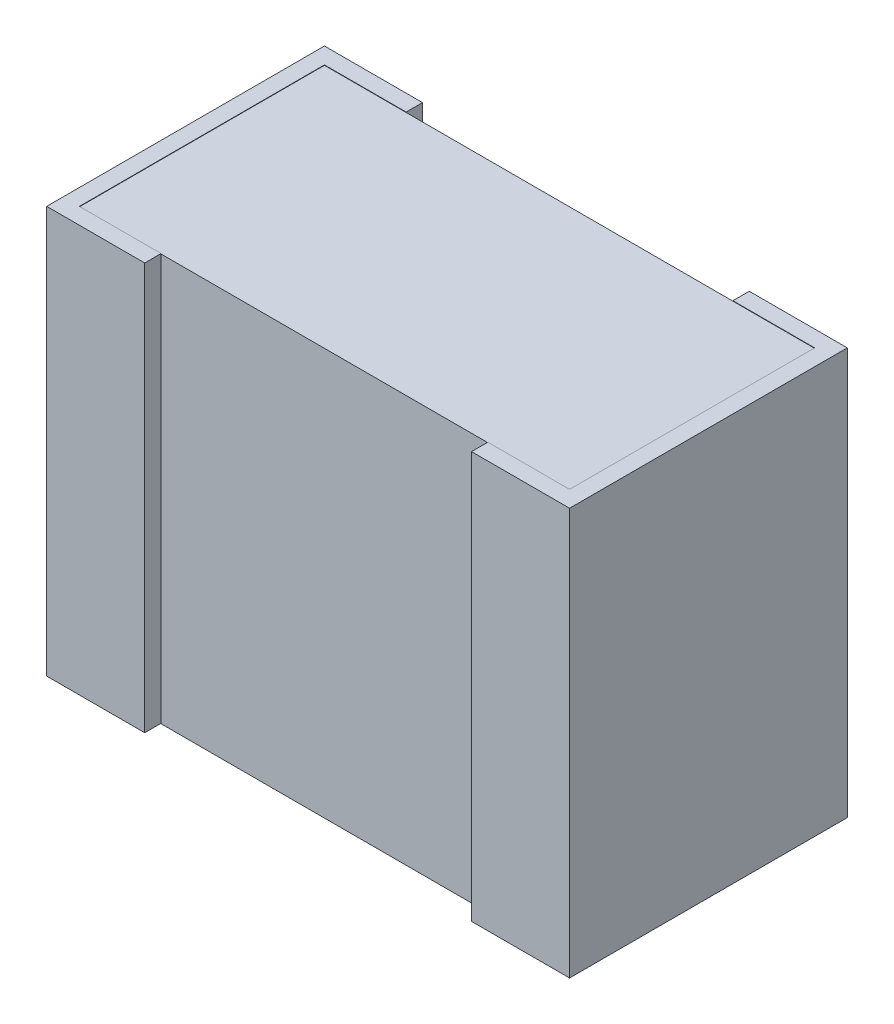
from build123d import *

# Parameters (mm, degrees)
SKETCH2_W           = 3
SKETCH2_H           = 1.5
BASE_EXTRUDE_DEPTH  = 1.245
BOSS_EXTRUDE8_DEPTH = 2.49


with BuildPart() as part:
    # Sketch2 → Base-Extrude (new, symmetric)
    with BuildSketch(Plane(origin=(0, 0, 0), x_dir=(1, 0, 0), z_dir=(0, 1, 0))):
        Rectangle(SKETCH2_W, SKETCH2_H)
    extrude(amount=BASE_EXTRUDE_DEPTH, both=True)

    # Sketch3 → Boss-Extrude8 (add)
    with BuildSketch(Plane(origin=(0, 1.24754, 0), x_dir=(-1, 0, 0), z_dir=(0, 1, 0))):
        Polygon((1, 0.85), (1, 0.75), (1.5, 0.75), (1.5, -0.75), (1, -0.75), (1, -0.85), (1.6, -0.85), (1.6, 0.85), align=None)
    boss_extrude8 = extrude(amount=-BOSS_EXTRUDE8_DEPTH)

    # Espelhar1: Boss-Extrude8 across plane
    add(boss_extrude8.mirror(Plane(origin=(0, 0, 0), x_dir=(0, 0, 1), z_dir=(1, 0, 0))))


solid = part.part
